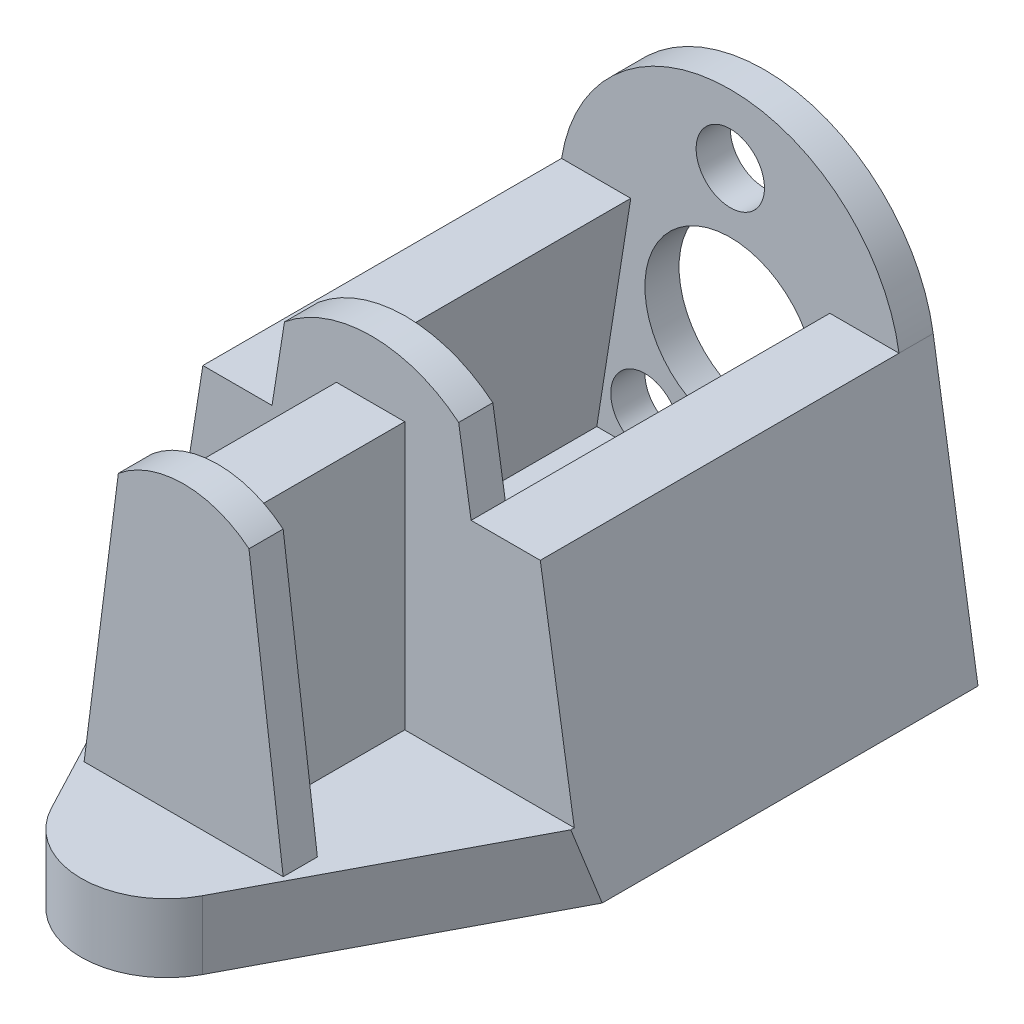
from build123d import *

# Parameters (mm, degrees)
SKETCH1_R           = 5
SKETCH1_R_2         = 2
BOSS_EXTRUDE1_DEPTH = 2
BOSS_EXTRUDE2_DEPTH = 48
BOSS_EXTRUDE3_DEPTH = 1
CUT_EXTRUDE2_DEPTH  = 36
BOSS_EXTRUDE4_DEPTH = 21
BOSS_EXTRUDE5_DEPTH = 1
SKETCH8_W           = 4
SKETCH8_H           = 15.623627573
BOSS_EXTRUDE6_DEPTH = 9
SKETCH11_R          = 5
SKETCH11_R_2        = 2.5
BOSS_EXTRUDE7_DEPTH = 5


with BuildPart() as part:
    # Sketch1 → Boss-Extrude1 (new body)
    with BuildSketch(Plane.XY):
        with BuildLine():
            Line((-12.5, 0), (12.5, 0))
            Line((12.5, 0), (9.876921901, 16.564101584))
            ThreePointArc((9.876921901, 16.564101584), (0, 25), (-9.876921901, 16.564101584))
            Line((-9.876921901, 16.564101584), (-12.5, 0))
        make_face()
        with Locations((0, 12.5)):
            Circle(SKETCH1_R, mode=Mode.SUBTRACT)
        with Locations((5, 6.1)):
            Circle(SKETCH1_R_2, mode=Mode.SUBTRACT)
        with Locations((-5, 6.1)):
            Circle(SKETCH1_R_2, mode=Mode.SUBTRACT)
        with Locations((0, 21)):
            Circle(SKETCH1_R_2, mode=Mode.SUBTRACT)
    extrude(amount=BOSS_EXTRUDE1_DEPTH)

    # Sketch2 → Boss-Extrude2 (add)
    with BuildSketch(Plane(origin=(0, 0, 50), x_dir=(-1, 0, 0), z_dir=(0, 0, -1))):
        Polygon((12.5, 0), (-12.5, 0), (-11.866563146, 4), (11.866563146, 4), align=None)
    extrude(amount=BOSS_EXTRUDE2_DEPTH)

    # Sketch3 → Boss-Extrude3 (add, symmetric)
    with BuildSketch(Plane.XY.offset(22)):
        with BuildLine():
            ThreePointArc((5.92615314, 15.93846095), (0, 21), (-5.92615314, 15.93846095))
            Line((-5.92615314, 15.93846095), (-7.183281573, 8))
            Line((-7.183281573, 8), (-7.816718427, 4))
            Line((-7.816718427, 4), (7.816718427, 4))
            Line((7.816718427, 4), (7.183281573, 8))
            Line((7.183281573, 8), (5.92615314, 15.93846095))
        make_face()
        with BuildLine():
            Line((5.92615314, 15.93846095), (5.098508377, 21.164836764))
            ThreePointArc((5.098508377, 21.164836764), (0, 23), (-5.098508377, 21.164836764))
            Line((-5.098508377, 21.164836764), (-5.92615314, 15.93846095))
            ThreePointArc((-5.92615314, 15.93846095), (0, 21), (5.92615314, 15.93846095))
        make_face()
    extrude(amount=BOSS_EXTRUDE3_DEPTH, both=True)

    # Sketch4 → Cut-Extrude2 (cut)
    with BuildSketch(Plane(origin=(0, 4, 0), x_dir=(1, 0, 0), z_dir=(0, 1, 0))):
        with BuildLine():
            Line((-12.5, -22), (-4.423680321, -37.330461847))
            ThreePointArc((-4.423680321, -37.330461847), (0, -40), (4.423680321, -37.330461847))
            Line((4.423680321, -37.330461847), (12.5, -22))
            Line((12.5, -22), (16.181982352, -22))
            Line((16.181982352, -22), (16.181982352, -36.988467345))
            Line((16.181982352, -36.988467345), (30.820243312, -58.391823719))
            Line((30.820243312, -58.391823719), (-16.187396411, -58.391823719))
            Line((-16.187396411, -58.391823719), (-16.187396411, -22))
            Line((-16.187396411, -22), (-12.5, -22))
        make_face()
    extrude(amount=-CUT_EXTRUDE2_DEPTH, mode=Mode.SUBTRACT)

    # Sketch6 → Boss-Extrude4 (add)
    with BuildSketch(Plane.XY.offset(2)):
        Polygon((-7.866563146, 4), (-7.816718427, 4), (-5.827077182, 16.564101584), (-9.876921901, 16.564101584), (-11.866563146, 4), align=None)
        Polygon((7.866563146, 4), (11.866563146, 4), (9.876921901, 16.564101584), (5.827077182, 16.564101584), (7.816718427, 4), align=None)
    extrude(amount=BOSS_EXTRUDE4_DEPTH)

    # Sketch7 → Boss-Extrude5 (add, symmetric)
    with BuildSketch(Plane.XY.offset(33)):
        with BuildLine():
            ThreePointArc((3.823881283, 19.623627573), (2.032022953, 20.645430251), (0, 21))
            Line((0, 21), (0, 4))
            Line((0, 4), (5.827077182, 4))
            Line((5.827077182, 4), (3.823881283, 19.623627573))
        make_face()
        with BuildLine():
            ThreePointArc((0, 21), (-2.032022953, 20.645430251), (-3.823881283, 19.623627573))
            Line((-3.823881283, 19.623627573), (-5.827077182, 4))
            Line((-5.827077182, 4), (0, 4))
            Line((0, 4), (0, 21))
        make_face()
    extrude(amount=BOSS_EXTRUDE5_DEPTH, both=True)

    # Sketch8 → Boss-Extrude6 (add)
    with BuildSketch(Plane(origin=(0, 0, 32), x_dir=(-1, 0, 0), z_dir=(0, 0, -1))):
        with Locations((0.057647427, 11.811813787)):
            Rectangle(SKETCH8_W, SKETCH8_H)
    extrude(amount=BOSS_EXTRUDE6_DEPTH)

    # Sketch11 → Boss-Extrude7 (add)
    with BuildSketch(Plane.XZ):
        with Locations(Location((0, 10, 0), (0, 0, 90))):
            Circle(SKETCH11_R)
        with Locations(Location((0, 10, 0), (0, 0, 270))):
            Circle(SKETCH11_R_2, mode=Mode.SUBTRACT)
    extrude(amount=BOSS_EXTRUDE7_DEPTH)


solid = part.part
